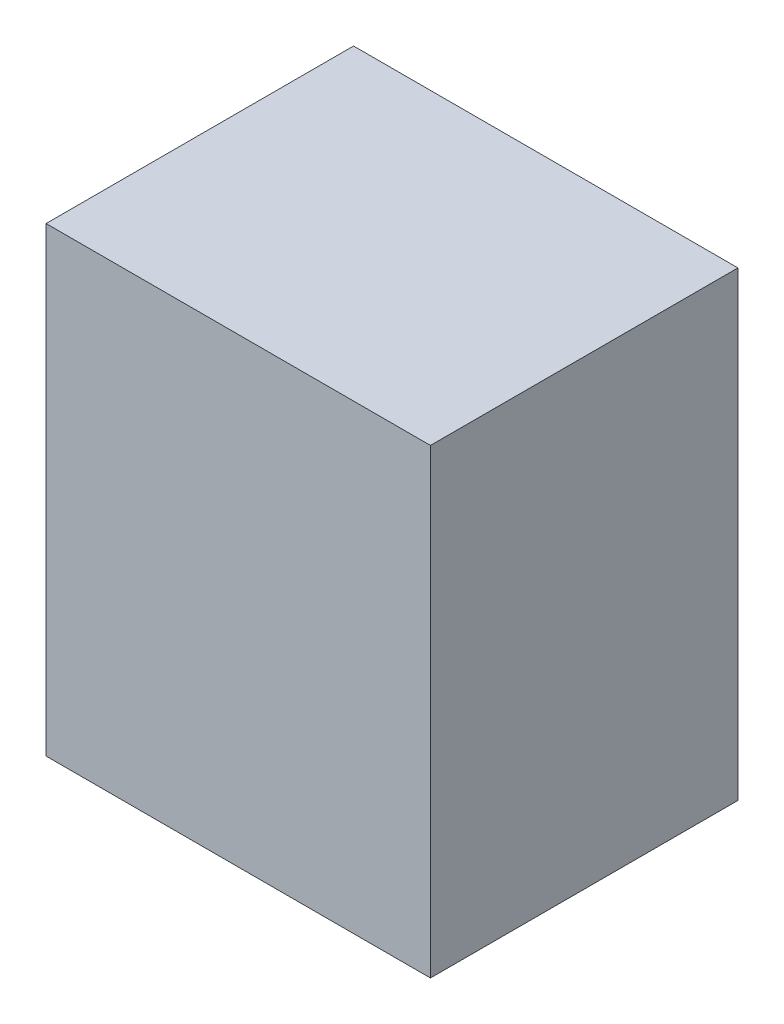
from build123d import *

# Parameters (mm, degrees)
SKETCH1_W           = 111.125
SKETCH1_H           = 88.9
BOSS_EXTRUDE1_DEPTH = 133.35


with BuildPart() as part:
    # Sketch1 → Boss-Extrude1 (new body)
    with BuildSketch(Plane(origin=(0, 0, 0), x_dir=(1, 0, 0), z_dir=(0, 1, 0))):
        with Locations((55.5625, 44.45)):
            Rectangle(SKETCH1_W, SKETCH1_H)
    extrude(amount=BOSS_EXTRUDE1_DEPTH)


solid = part.part
